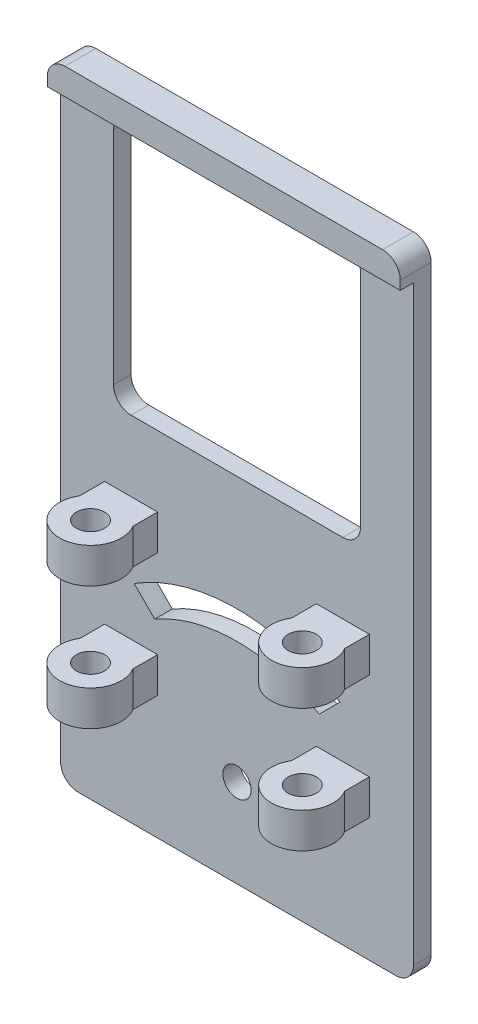
from build123d import *

# Parameters (mm, degrees)
SKETCH1_W                                    = 40
SKETCH1_H                                    = 40
BOSS_EXTRUDE2_DEPTH                          = 2
SKETCH2_W                                    = 6
SKETCH2_H                                    = 4
BOSS_EXTRUDE5_DEPTH                          = 3
SKETCH4_R                                    = 3.5
SKETCH4_R_2                                  = 1.6
BOSS_EXTRUDE6_DEPTH                          = 4
MIRROR2_AT_THE_SECOND_PLANE_COPY_1_SKETC_W   = 6
MIRROR2_AT_THE_SECOND_PLANE_COPY_1_SKETC_H   = 4
MIRROR2_AT_THE_SECOND_PLANE_COPY_1_DEPTH     = 3
MIRROR2_AT_THE_SECOND_PLANE_COPY_2_SKETC_R   = 3.5
MIRROR2_AT_THE_SECOND_PLANE_COPY_2_SKETC_R_2 = 1.6
MIRROR2_AT_THE_SECOND_PLANE_COPY_2_DEPTH     = 4
CUT_EXTRUDE2_DEPTH                           = 2
SKETCH8_R                                    = 1.6
CUT_EXTRUDE3_DEPTH                           = 2
SKETCH18_W                                   = 6
SKETCH18_H                                   = 2
BOSS_EXTRUDE10_DEPTH                         = 32
SKETCH19_W                                   = 6
SKETCH19_H                                   = 2
BOSS_EXTRUDE11_DEPTH                         = 3
FILLET1_R                                    = 2


with BuildPart() as part:
    # Sketch1 → Boss-Extrude2 (new body)
    with BuildSketch(Plane.XY):
        Rectangle(SKETCH1_W, SKETCH1_H)
    extrude(amount=BOSS_EXTRUDE2_DEPTH)

    # Sketch2 → Boss-Extrude5 (add)
    with BuildSketch(Plane.XY.offset(2)):
        with Locations((-12, 10)):
            Rectangle(SKETCH2_W, SKETCH2_H)
    boss_extrude5 = extrude(amount=BOSS_EXTRUDE5_DEPTH)

    # Sketch4 → Boss-Extrude6 (add)
    with BuildSketch(Plane(origin=(0, 12, 0), x_dir=(1, 0, 0), z_dir=(0, 1, 0))):
        with Locations((-12, -6.6)):
            Circle(SKETCH4_R)
        with Locations(Location((-12, -6.6, 0), (0, 0, 270))):
            Circle(SKETCH4_R_2, mode=Mode.SUBTRACT)
    boss_extrude6 = extrude(amount=-BOSS_EXTRUDE6_DEPTH)

    # Mirror2: Boss-Extrude5, Boss-Extrude6 across plane
    add(boss_extrude5.mirror(Plane(origin=(0, 0, 0), x_dir=(0, 0, 1), z_dir=(1, 0, 0))))
    add(boss_extrude6.mirror(Plane(origin=(0, 0, 0), x_dir=(0, 0, 1), z_dir=(1, 0, 0))))

    # Mirror2 at the second plane: Boss-Extrude5, Boss-Extrude6 across plane
    add(boss_extrude5.mirror(Plane(origin=(0, 3, 0), x_dir=(0, 0, 1), z_dir=(0, -1, 0))))
    add(boss_extrude6.mirror(Plane(origin=(0, 3, 0), x_dir=(0, 0, 1), z_dir=(0, -1, 0))))

    # Mirror2 at the second plane copy 1 sketc → Mirror2 at the second plane copy 1 (add)
    with BuildSketch(Plane(origin=(0, 6, 2), x_dir=(-1, 0, 0), z_dir=(0, 0, 1))):
        with Locations((-12, 10)):
            Rectangle(MIRROR2_AT_THE_SECOND_PLANE_COPY_1_SKETC_W, MIRROR2_AT_THE_SECOND_PLANE_COPY_1_SKETC_H)
    extrude(amount=MIRROR2_AT_THE_SECOND_PLANE_COPY_1_DEPTH)

    # Mirror2 at the second plane copy 2 sketc → Mirror2 at the second plane copy 2 (add)
    with BuildSketch(Plane(origin=(0, -6, 0), x_dir=(-1, 0, 0), z_dir=(0, -1, 0))):
        with Locations((-12, -6.6)):
            Circle(MIRROR2_AT_THE_SECOND_PLANE_COPY_2_SKETC_R)
        with Locations(Location((-12, -6.6, 0), (0, 0, 270))):
            Circle(MIRROR2_AT_THE_SECOND_PLANE_COPY_2_SKETC_R_2, mode=Mode.SUBTRACT)
    extrude(amount=-MIRROR2_AT_THE_SECOND_PLANE_COPY_2_DEPTH)

    # Sketch7 → Cut-Extrude2 (cut)
    with BuildSketch(Plane.XY.offset(2)):
        with BuildLine():
            ThreePointArc((9.324585763, 1.324585763), (0, 3.8), (-9.324585763, 1.324585763))
            Line((-9.324585763, 1.324585763), (-11.657506391, 3.657506391))
            ThreePointArc((-11.657506391, 3.657506391), (0, 7), (11.657506391, 3.657506391))
            Line((11.657506391, 3.657506391), (9.324585763, 1.324585763))
        make_face()
    extrude(amount=-CUT_EXTRUDE2_DEPTH, mode=Mode.SUBTRACT)

    # Sketch8 → Cut-Extrude3 (cut)
    with BuildSketch(Plane(origin=(0, 0, 0), x_dir=(-1, 0, 0), z_dir=(0, 0, -1))):
        with Locations((0, -10)):
            Circle(SKETCH8_R)
    extrude(amount=-CUT_EXTRUDE3_DEPTH, mode=Mode.SUBTRACT)

    # Sketch18 → Boss-Extrude10 (add)
    with BuildSketch(Plane(origin=(0, 20, 0), x_dir=(1, 0, 0), z_dir=(0, 1, 0))):
        with Locations((17, -1)):
            Rectangle(SKETCH18_W, SKETCH18_H)
        with Locations((-17, -1)):
            Rectangle(SKETCH18_W, SKETCH18_H)
    extrude(amount=BOSS_EXTRUDE10_DEPTH)

    # Sketch19 → Boss-Extrude11 (add)
    with BuildSketch(Plane(origin=(0, 52, 0), x_dir=(1, 0, 0), z_dir=(0, 1, 0))):
        Polygon((20, 0), (-14, 0), (-14, -2), (-20, -2), (-20, -3.5), (20, -3.5), align=None)
        with Locations((-17, -1)):
            Rectangle(SKETCH19_W, SKETCH19_H)
    extrude(amount=-BOSS_EXTRUDE11_DEPTH)

    # Fillet1
    fillet1_edges = [part.edges().sort_by_distance(p)[0] for p in [
        (20, 52, 1.75),
        (14, 20, 1),
        (-20, 52, 1.75),
        (-14, 20, 1),
        (-14, 49, 1),
        (14, 49, 1),
        (20, -20, 1),
        (-20, -20, 1),
    ]]
    fillet(fillet1_edges, radius=FILLET1_R)


solid = part.part
